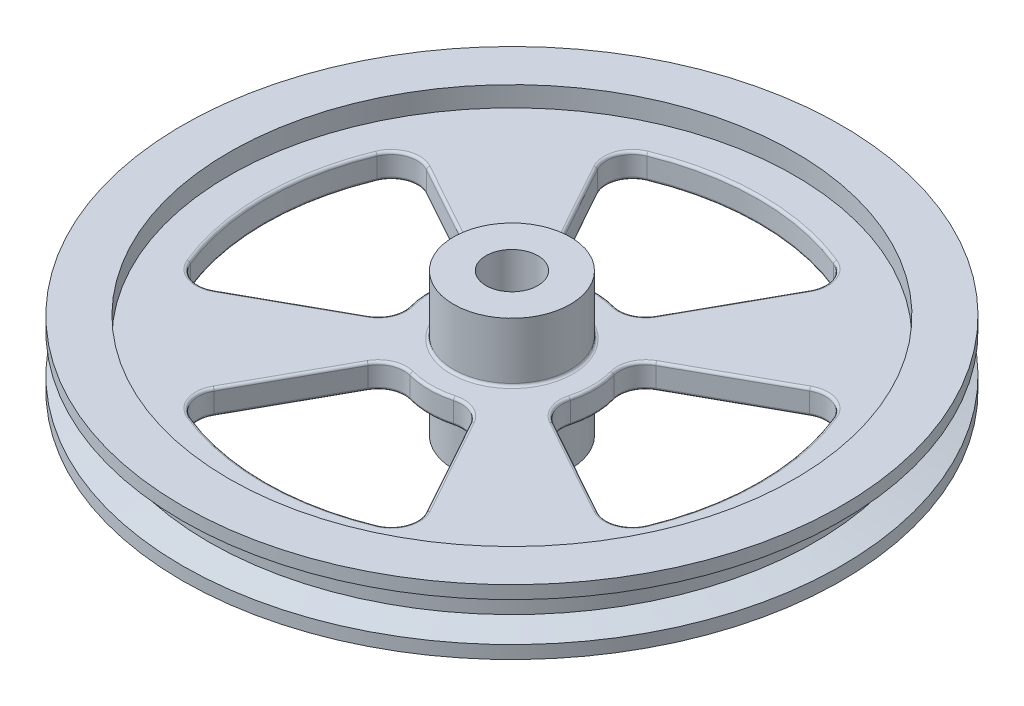
from build123d import *

# Parameters (mm, degrees)
CUT_EXTRUDE1_DEPTH = 10
FILLET1_R          = 1
FILLET2_R          = 1
FILLET3_R          = 1


with BuildPart() as part:
    # Sketch3 → Revolve1 (revolve)
    with BuildSketch(Plane.XY, mode=Mode.PRIVATE) as revolve1_sk:
        Polygon((-10, 27.5), (-10, -27.5), (-22.5, -27.5), (-22.5, -12.5), (-22.5, -4.75), (-109, -4.75), (-109, -12.5), (-127, -12.5), (-127, -7.5), (-116.736860279, -4.75), (-116.736860279, 4.75), (-127, 7.5), (-127, 12.5), (-109, 12.5), (-109, 4.75), (-22.5, 4.75), (-22.5, 12.5), (-22.5, 27.5), align=None)
    revolve(revolve1_sk.sketch.rotate(Axis((0, 118.75, 0), (0, -1, 0)), 270), axis=Axis((0, 118.75, 0), (0, -1, 0)))

    # Sketch4 → Cut-Extrude1 (cut)
    with BuildSketch(Plane(origin=(0, 4.75, 0), x_dir=(1, 0, 0), z_dir=(0, 1, 0))):
        with BuildLine():
            Line((-19.776429712, 35.677623629), (-40.922641913, 73.826400284))
            ThreePointArc((-40.922641913, 73.826400284), (-41.609936664, 81.992512767), (-35.961908941, 87.930319602))
            ThreePointArc((-35.961908941, 87.930319602), (0, 95), (35.961908941, 87.930319602))
            ThreePointArc((35.961908941, 87.930319602), (41.609936664, 81.992512767), (40.922641913, 73.826400284))
            Line((40.922641913, 73.826400284), (19.776429712, 35.677623629))
            ThreePointArc((19.776429712, 35.677623629), (14.919393757, 31.312988108), (8.403986774, 30.87673892))
            ThreePointArc((8.403986774, 30.87673892), (0, 32), (-8.403986774, 30.87673892))
            ThreePointArc((-8.403986774, 30.87673892), (-14.919393757, 31.312988108), (-19.776429712, 35.677623629))
        make_face()
        with BuildLine():
            Line((35.677623629, 19.776429712), (73.826400284, 40.922641913))
            ThreePointArc((73.826400284, 40.922641913), (81.992512767, 41.609936664), (87.930319602, 35.961908941))
            ThreePointArc((87.930319602, 35.961908941), (95, 0), (87.930319602, -35.961908941))
            ThreePointArc((87.930319602, -35.961908941), (81.992512767, -41.609936664), (73.826400284, -40.922641913))
            Line((73.826400284, -40.922641913), (35.677623629, -19.776429712))
            ThreePointArc((35.677623629, -19.776429712), (31.312988108, -14.919393757), (30.87673892, -8.403986774))
            ThreePointArc((30.87673892, -8.403986774), (32, 0), (30.87673892, 8.403986774))
            ThreePointArc((30.87673892, 8.403986774), (31.312988108, 14.919393757), (35.677623629, 19.776429712))
        make_face()
        with BuildLine():
            Line((19.776429712, -35.677623629), (40.922641913, -73.826400284))
            ThreePointArc((40.922641913, -73.826400284), (41.609936664, -81.992512767), (35.961908941, -87.930319602))
            ThreePointArc((35.961908941, -87.930319602), (0, -95), (-35.961908941, -87.930319602))
            ThreePointArc((-35.961908941, -87.930319602), (-41.609936664, -81.992512767), (-40.922641913, -73.826400284))
            Line((-40.922641913, -73.826400284), (-19.776429712, -35.677623629))
            ThreePointArc((-19.776429712, -35.677623629), (-14.919393757, -31.312988108), (-8.403986774, -30.87673892))
            ThreePointArc((-8.403986774, -30.87673892), (0, -32), (8.403986774, -30.87673892))
            ThreePointArc((8.403986774, -30.87673892), (14.919393757, -31.312988108), (19.776429712, -35.677623629))
        make_face()
        with BuildLine():
            Line((-35.677623629, -19.776429712), (-73.826400284, -40.922641913))
            ThreePointArc((-73.826400284, -40.922641913), (-81.992512767, -41.609936664), (-87.930319602, -35.961908941))
            ThreePointArc((-87.930319602, -35.961908941), (-95, 0), (-87.930319602, 35.961908941))
            ThreePointArc((-87.930319602, 35.961908941), (-81.992512767, 41.609936664), (-73.826400284, 40.922641913))
            Line((-73.826400284, 40.922641913), (-35.677623629, 19.776429712))
            ThreePointArc((-35.677623629, 19.776429712), (-31.312988108, 14.919393757), (-30.87673892, 8.403986774))
            ThreePointArc((-30.87673892, 8.403986774), (-32, 0), (-30.87673892, -8.403986774))
            ThreePointArc((-30.87673892, -8.403986774), (-31.312988108, -14.919393757), (-35.677623629, -19.776429712))
        make_face()
    extrude(amount=-CUT_EXTRUDE1_DEPTH, mode=Mode.SUBTRACT)

    # Fillet1
    fillet1_edges = [part.edges().sort_by_distance(p)[0] for p in [
        (0, 4.75, -22.5),
    ]]
    fillet(fillet1_edges, radius=FILLET1_R)

    # Fillet2
    fillet2_edges = [part.edges().sort_by_distance(p)[0] for p in [
        (-14.919393757, 4.75, -31.312988108),
        (0, 4.75, -32),
        (14.919393757, 4.75, -31.312988108),
        (30.349535813, 4.75, -54.752011956),
        (41.609936664, 4.75, -81.992512767),
        (0, 4.75, -95),
        (-41.609936664, 4.75, -81.992512767),
        (-30.349535813, 4.75, -54.752011956),
        (0, -4.75, -22.5),
        (0, -4.75, -32),
        (14.919393757, -4.75, -31.312988108),
        (30.349535813, -4.75, -54.752011956),
        (41.609936664, -4.75, -81.992512767),
        (0, -4.75, -95),
        (-41.609936664, -4.75, -81.992512767),
        (-30.349535813, -4.75, -54.752011956),
        (-14.919393757, -4.75, -31.312988108),
        (32, -4.75, 0),
        (31.312988108, -4.75, -14.919393757),
        (54.752011956, -4.75, -30.349535813),
        (81.992512767, -4.75, -41.609936664),
        (95, -4.75, 0),
        (81.992512767, -4.75, 41.609936664),
        (54.752011956, -4.75, 30.349535813),
        (31.312988108, -4.75, 14.919393757),
        (32, 4.75, 0),
        (31.312988108, 4.75, 14.919393757),
        (54.752011956, 4.75, 30.349535813),
        (81.992512767, 4.75, 41.609936664),
        (95, 4.75, 0),
        (81.992512767, 4.75, -41.609936664),
        (54.752011956, 4.75, -30.349535813),
        (31.312988108, 4.75, -14.919393757),
    ]]
    fillet(fillet2_edges, radius=FILLET2_R)

    # Fillet3
    fillet3_edges = [part.edges().sort_by_distance(p)[0] for p in [
        (-54.752011956, -4.75, 30.349535813),
        (-81.992512767, -4.75, 41.609936664),
        (-95, -4.75, 0),
        (-81.992512767, -4.75, -41.609936664),
        (-54.752011956, -4.75, -30.349535813),
        (-31.312988108, -4.75, -14.919393757),
        (-32, 4.75, 0),
        (-31.312988108, 4.75, -14.919393757),
        (-54.752011956, 4.75, -30.349535813),
        (-81.992512767, 4.75, -41.609936664),
        (-95, 4.75, 0),
        (-81.992512767, 4.75, 41.609936664),
        (-54.752011956, 4.75, 30.349535813),
        (-31.312988108, 4.75, 14.919393757),
        (0, -4.75, 32),
        (14.919393757, -4.75, 31.312988108),
        (30.349535813, -4.75, 54.752011956),
        (41.609936664, -4.75, 81.992512767),
        (0, -4.75, 95),
        (-41.609936664, -4.75, 81.992512767),
        (-30.349535813, -4.75, 54.752011956),
        (-14.919393757, -4.75, 31.312988108),
        (0, 4.75, 32),
        (-14.919393757, 4.75, 31.312988108),
        (-30.349535813, 4.75, 54.752011956),
        (-41.609936664, 4.75, 81.992512767),
        (0, 4.75, 95),
        (41.609936664, 4.75, 81.992512767),
        (30.349535813, 4.75, 54.752011956),
        (14.919393757, 4.75, 31.312988108),
        (-32, -4.75, 0),
        (-31.312988108, -4.75, 14.919393757),
    ]]
    fillet(fillet3_edges, radius=FILLET3_R)


solid = part.part
